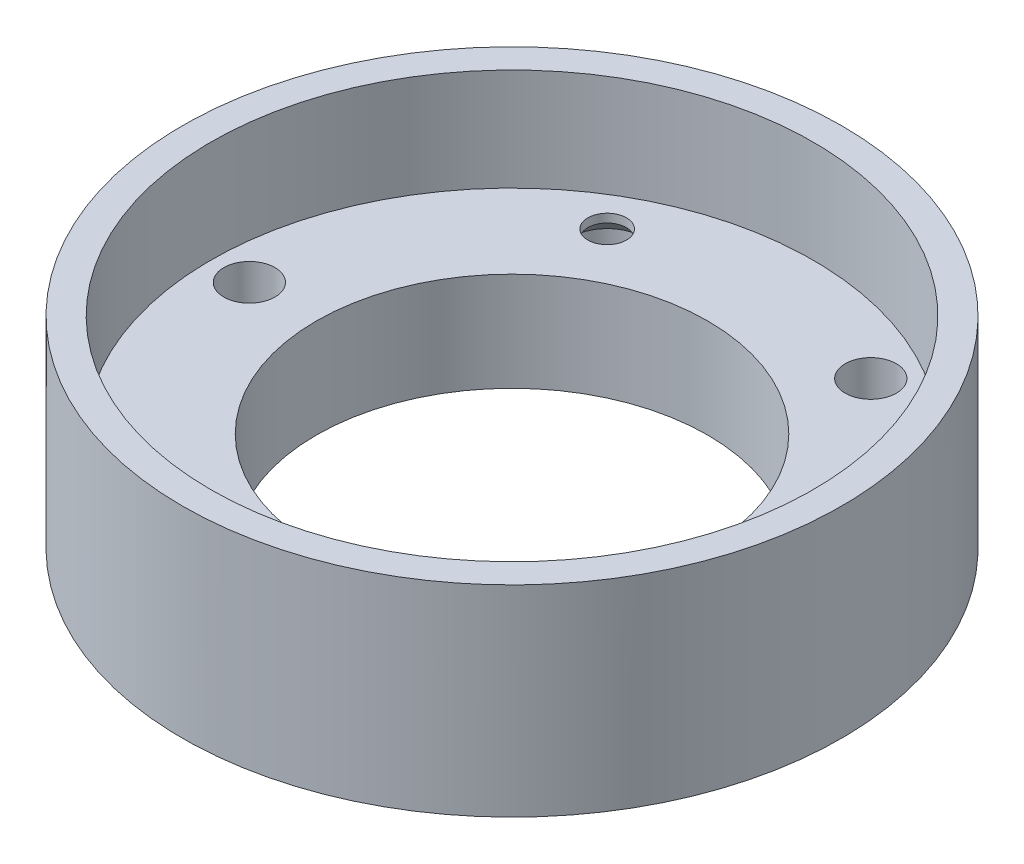
from build123d import *

# Parameters (mm, degrees)
ESQUISSE1_R                                    = 29
BOSS_EXTRU_1_DEPTH                             = 11.2
ESQUISSE2_R                                    = 26.5
ENL_V_MAT_EXTRU_1_DEPTH                        = 9
ESQUISSE3_R                                    = 17.225
ENL_V_MAT_EXTRU_2_DEPTH                        = 42.98809355
FRAISAGE_POUR_VIS_T_TE_FRAIS_E_M31_D           = 3.4
FRAISAGE_POUR_VIS_T_TE_FRAIS_E_M31_CSINK_D     = 6.3
FRAISAGE_POUR_VIS_T_TE_FRAIS_E_M31_CSINK_ANGLE = 90
ESQUISSE7_R                                    = 29
ESQUISSE7_R_2                                  = 17.225
ESQUISSE7_R_3                                  = 3.15
BOSS_EXTRU_2_DEPTH                             = 6.5
DIAM_TRE_DU_PER_AGE_4_5_4_5_1_D                = 4.5


with BuildPart() as part:
    # Esquisse1 → Boss.-Extru.1 (new body)
    with BuildSketch(Plane(origin=(0, 0, 0), x_dir=(1, 0, 0), z_dir=(0, 1, 0))):
        with Locations(Location((0, 0, 0), (0, 0, 270))):
            Circle(ESQUISSE1_R)
    extrude(amount=BOSS_EXTRU_1_DEPTH)

    # Esquisse2 → Enlèv. mat.-Extru.1 (cut)
    with BuildSketch(Plane(origin=(0, 11.2, 0), x_dir=(1, 0, 0), z_dir=(0, 1, 0))):
        with Locations(Location((0, 0, 0), (0, 0, 270))):
            Circle(ESQUISSE2_R)
    extrude(amount=-ENL_V_MAT_EXTRU_1_DEPTH, mode=Mode.SUBTRACT)

    # Esquisse3 → Enlèv. mat.-Extru.2 (cut, through all)
    with BuildSketch(Plane(origin=(0, 2.2, 0), x_dir=(1, 0, 0), z_dir=(0, 1, 0))):
        with Locations(Location((0, 0, 0), (0, 0, 270))):
            Circle(ESQUISSE3_R)
    extrude(amount=-ENL_V_MAT_EXTRU_2_DEPTH, mode=Mode.SUBTRACT)

    # Fraisage pour vis à tête fraisée M31 (through all)
    with Locations(Plane(origin=(0, 0, 0), x_dir=(-1, 0, 0), z_dir=(0, -1, 0))):
        with Locations((-22.875, 0), (11.4375, 19.810331112), (11.4375, -19.810331112), (0, 0)):
            CounterSinkHole(FRAISAGE_POUR_VIS_T_TE_FRAIS_E_M31_D / 2, FRAISAGE_POUR_VIS_T_TE_FRAIS_E_M31_CSINK_D / 2, counter_sink_angle=FRAISAGE_POUR_VIS_T_TE_FRAIS_E_M31_CSINK_ANGLE)

    # Esquisse7 → Boss.-Extru.2 (add)
    with BuildSketch(Plane.XZ):
        with Locations(Location((0, 0, 0), (0, 0, 270))):
            Circle(ESQUISSE7_R)
        with Locations(Location((0, 0, 0), (0, 0, 90))):
            Circle(ESQUISSE7_R_2, mode=Mode.SUBTRACT)
        with Locations(Location((-11.4375, 19.810331112, 0), (0, 0, 90))):
            Circle(ESQUISSE7_R_3, mode=Mode.SUBTRACT)
        with Locations(Location((-11.4375, -19.810331112, 0), (0, 0, 90))):
            Circle(ESQUISSE7_R_3, mode=Mode.SUBTRACT)
        with Locations(Location((22.875, 0, 0), (0, 0, 90))):
            Circle(ESQUISSE7_R_3, mode=Mode.SUBTRACT)
    extrude(amount=BOSS_EXTRU_2_DEPTH)

    # Diamètre du perçage Ø4.5 (4.5)1 (through all)
    with Locations(Plane(origin=(0, -6.5, 0), x_dir=(-1, 0, 0), z_dir=(0, -1, 0))):
        with Locations((0, 0), (23.1125, 0), (-11.55625, -20.016012145), (-11.55625, 20.016012145)):
            Hole(DIAM_TRE_DU_PER_AGE_4_5_4_5_1_D / 2)


solid = part.part
